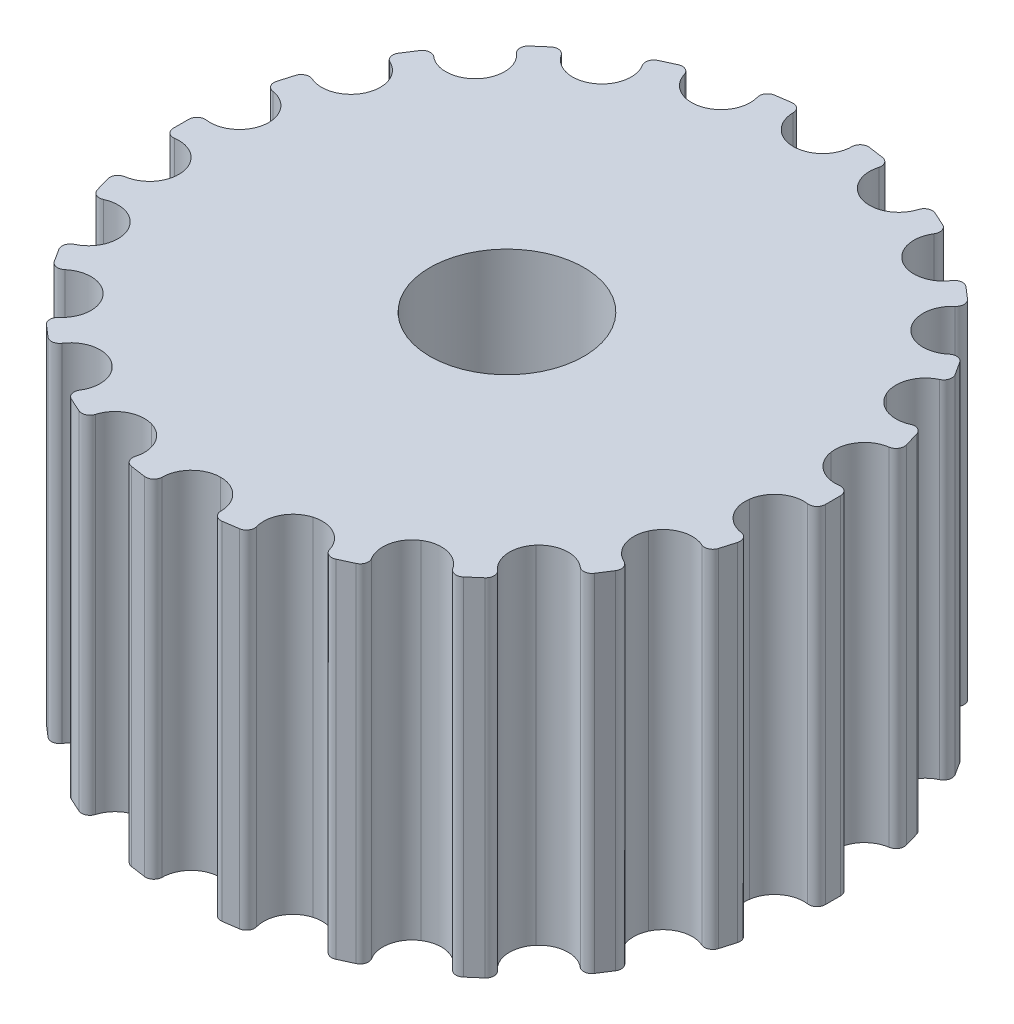
from build123d import *

# Parameters (mm, degrees)
AUFSATZ_LINEAR_AUSTRAGEN1_DEPTH = 18
F_8_0_8_DURCHMESSER_BOHRUNG1_D  = 8


with BuildPart() as part:
    # Skizze1 → Aufsatz-Linear austragen1 (new body)
    with BuildSketch(Plane(origin=(0, 0, 0), x_dir=(1, 0, 0), z_dir=(0, 1, 0))):
        with BuildLine():
            Line((2.016149839, 16.814436139), (2.801632478, 16.701526227))
            ThreePointArc((2.801632478, 16.701526227), (3.101511816, 16.50942794), (3.153726656, 16.157145411))
            ThreePointArc((3.153726656, 16.157145411), (3.283097912, 15.001210678), (4.189865695, 14.272723054))
            ThreePointArc((4.189865695, 14.272723054), (5.346528394, 14.395402891), (6.080251078, 15.297938189))
            ThreePointArc((6.080251078, 15.297938189), (6.314618428, 15.566081904), (6.67074882, 15.565580692))
            Line((6.67074882, 15.565580692), (7.392603495, 15.235948392))
            ThreePointArc((7.392603495, 15.235948392), (7.626215271, 14.967145662), (7.577065585, 14.614422431))
            ThreePointArc((7.577065585, 14.614422431), (7.375531949, 13.468863082), (8.040330584, 12.514418319))
            ThreePointArc((8.040330584, 12.514418319), (9.184703221, 12.306259221), (10.142978558, 12.965521931))
            ThreePointArc((10.142978558, 12.965521931), (10.443397198, 13.156775028), (10.784960599, 13.055960593))
            Line((10.784960599, 13.055960593), (11.384706937, 12.536310754))
            ThreePointArc((11.384706937, 12.536310754), (11.533125314, 12.212580381), (11.386592918, 11.887991985))
            ThreePointArc((11.386592918, 11.887991985), (10.870481446, 10.845614425), (11.239452902, 9.742535963))
            ThreePointArc((11.239452902, 9.742535963), (12.278825211, 9.220401742), (13.384019433, 9.582982318))
            ThreePointArc((13.384019433, 9.582982318), (13.726151231, 9.68185061), (14.025476205, 9.488890337))
            Line((14.025476205, 9.488890337), (14.454526325, 8.821321899))
            ThreePointArc((14.454526325, 8.821321899), (14.505727329, 8.468890591), (14.273683407, 8.198733253))
            ThreePointArc((14.273683407, 8.198733253), (13.48480638, 7.343984713), (13.528058784, 6.181637408))
            ThreePointArc((13.528058784, 6.181637408), (14.378227002, 5.387828273), (15.540803845, 5.424352595))
            ThreePointArc((15.540803845, 5.424352595), (15.896931319, 5.422826359), (16.129768337, 5.153352743))
            Line((16.129768337, 5.153352743), (16.353363149, 4.39194813))
            ThreePointArc((16.353363149, 4.39194813), (16.30319878, 4.039367777), (16.004442149, 3.845528037))
            ThreePointArc((16.004442149, 3.845528037), (15.006709693, 3.247655161), (14.720738993, 2.120205477))
            ThreePointArc((14.720738993, 2.120205477), (15.312827547, 1.119031124), (16.43860195, 0.826540208))
            ThreePointArc((16.43860195, 0.826540208), (16.779873768, 0.724743092), (16.92735976, 0.400587283))
            Line((16.92735976, 0.400587283), (16.927384943, -0.392969032))
            ThreePointArc((16.927384943, -0.392969032), (16.779919219, -0.717134467), (16.438653365, -0.818952866))
            ThreePointArc((16.438653365, -0.818952866), (15.31289583, -1.111513974), (14.72086967, -2.112726767))
            ThreePointArc((14.72086967, -2.112726767), (15.006911068, -3.240157147), (16.004679484, -3.837967426))
            ThreePointArc((16.004679484, -3.837967426), (16.303447834, -4.031788426), (16.353634362, -4.384365253))
            Line((16.353634362, -4.384365253), (16.130087875, -5.145784056))
            ThreePointArc((16.130087875, -5.145784056), (15.897267592, -5.415272618), (15.541139845, -5.416820955))
            ThreePointArc((15.541139845, -5.416820955), (14.378559411, -5.380368734), (13.528440231, -6.17423233))
            ThreePointArc((13.528440231, -6.17423233), (13.485261098, -7.336581031), (14.274190264, -8.191279641))
            ThreePointArc((14.274190264, -8.191279641), (14.50625071, -8.4614223), (14.455071961, -8.813856467))
            Line((14.455071961, -8.813856467), (14.026064211, -9.481452135))
            ThreePointArc((14.026064211, -9.481452135), (13.726751084, -9.674431463), (13.384612796, -9.5755843))
            ThreePointArc((13.384612796, -9.5755843), (12.279394816, -9.213071892), (11.240054215, -9.735272184))
            ThreePointArc((11.240054215, -9.735272184), (10.871152669, -10.838372629), (11.387328235, -11.880716971))
            ThreePointArc((11.387328235, -11.880716971), (11.533880622, -12.205295936), (11.385482792, -12.529035323))
            Line((11.385482792, -12.529035323), (10.785769436, -13.048723226))
            ThreePointArc((10.785769436, -13.048723226), (10.444212034, -13.149559283), (10.143781215, -12.95832463))
            ThreePointArc((10.143781215, -12.95832463), (9.185463876, -12.299120634), (8.041103048, -12.50735206))
            ThreePointArc((8.041103048, -12.50735206), (7.376365299, -13.461837611), (7.577969791, -14.607383145))
            ThreePointArc((7.577969791, -14.607383145), (7.627141314, -14.96010296), (7.393546714, -15.228920127))
            Line((7.393546714, -15.228920127), (6.671712961, -15.558598241))
            ThreePointArc((6.671712961, -15.558598241), (6.315582234, -15.559121889), (6.081198001, -15.29099244))
            ThreePointArc((6.081198001, -15.29099244), (5.347418475, -14.388501644), (4.19074673, -14.265894532))
            ThreePointArc((4.19074673, -14.265894532), (3.284025875, -14.994438446), (3.154726497, -16.150379885))
            ThreePointArc((3.154726497, -16.150379885), (3.102533573, -16.502665289), (2.802666647, -16.694782268))
            Line((2.802666647, -16.694782268), (2.017191175, -16.807742033))
            ThreePointArc((2.017191175, -16.807742033), (1.675338716, -16.707910849), (1.525989487, -16.384608858))
            ThreePointArc((1.525989487, -16.384608858), (1.076194227, -15.311945698), (0.00091823, -14.868432948))
            ThreePointArc((0.00091823, -14.868432948), (-1.074328599, -15.312012929), (-1.524056781, -16.384702774))
            ThreePointArc((-1.524056781, -16.384702774), (-1.673385793, -16.708013697), (-2.015231609, -16.807866313))
            Line((-2.015231609, -16.807866313), (-2.800714248, -16.6949564))
            ThreePointArc((-2.800714248, -16.6949564), (-3.100593586, -16.502858113), (-3.152808426, -16.150575585))
            ThreePointArc((-3.152808426, -16.150575585), (-3.282179682, -14.994640851), (-4.188947465, -14.266153228))
            ThreePointArc((-4.188947465, -14.266153228), (-5.345610164, -14.388833064), (-6.079332848, -15.291368363))
            ThreePointArc((-6.079332848, -15.291368363), (-6.313700199, -15.559512077), (-6.66983059, -15.559010865))
            Line((-6.66983059, -15.559010865), (-7.391685265, -15.229378565))
            ThreePointArc((-7.391685265, -15.229378565), (-7.625297041, -14.960575836), (-7.576147355, -14.607852605))
            ThreePointArc((-7.576147355, -14.607852605), (-7.374613719, -13.462293255), (-8.039412354, -12.507848493))
            ThreePointArc((-8.039412354, -12.507848493), (-9.183784991, -12.299689395), (-10.142060328, -12.958952104))
            ThreePointArc((-10.142060328, -12.958952104), (-10.442478968, -13.150205201), (-10.784042369, -13.049390766))
            Line((-10.784042369, -13.049390766), (-11.383788707, -12.529740927))
            ThreePointArc((-11.383788707, -12.529740927), (-11.532207084, -12.206010554), (-11.385674688, -11.881422159))
            ThreePointArc((-11.385674688, -11.881422159), (-10.869563216, -10.839044599), (-11.238534672, -9.735966136))
            ThreePointArc((-11.238534672, -9.735966136), (-12.277906981, -9.213831915), (-13.383101203, -9.576412492))
            ThreePointArc((-13.383101203, -9.576412492), (-13.725233001, -9.675280783), (-14.024557975, -9.482320511))
            Line((-14.024557975, -9.482320511), (-14.453608095, -8.814752072))
            ThreePointArc((-14.453608095, -8.814752072), (-14.5048091, -8.462320765), (-14.272765177, -8.192163427))
            ThreePointArc((-14.272765177, -8.192163427), (-13.48388815, -7.337414887), (-13.527140554, -6.175067581))
            ThreePointArc((-13.527140554, -6.175067581), (-14.377308772, -5.381258446), (-15.539885615, -5.417782768))
            ThreePointArc((-15.539885615, -5.417782768), (-15.896013089, -5.416256533), (-16.128850107, -5.146782917))
            Line((-16.128850107, -5.146782917), (-16.352444919, -4.385378304))
            ThreePointArc((-16.352444919, -4.385378304), (-16.30228055, -4.03279795), (-16.003523919, -3.838958211))
            ThreePointArc((-16.003523919, -3.838958211), (-15.005791463, -3.241085334), (-14.719820763, -2.113635651))
            ThreePointArc((-14.719820763, -2.113635651), (-15.311909317, -1.112461298), (-16.43768372, -0.819970382))
            ThreePointArc((-16.43768372, -0.819970382), (-16.778955538, -0.718173266), (-16.926441531, -0.394017456))
            Line((-16.926441531, -0.394017456), (-16.926466713, 0.399538858))
            ThreePointArc((-16.926466713, 0.399538858), (-16.779000989, 0.723704294), (-16.437735135, 0.825522693))
            ThreePointArc((-16.437735135, 0.825522693), (-15.3119776, 1.118083801), (-14.71995144, 2.119296594))
            ThreePointArc((-14.71995144, 2.119296594), (-15.005992838, 3.246726973), (-16.003761254, 3.844537253))
            ThreePointArc((-16.003761254, 3.844537253), (-16.302529604, 4.038358252), (-16.352716132, 4.39093508))
            Line((-16.352716132, 4.39093508), (-16.129169645, 5.152353882))
            ThreePointArc((-16.129169645, 5.152353882), (-15.896349362, 5.421842445), (-15.540221615, 5.423390781))
            ThreePointArc((-15.540221615, 5.423390781), (-14.377641181, 5.38693856), (-13.527522001, 6.180802156))
            ThreePointArc((-13.527522001, 6.180802156), (-13.484342868, 7.343150858), (-14.273272034, 8.197849468))
            ThreePointArc((-14.273272034, 8.197849468), (-14.505332481, 8.467992126), (-14.454153731, 8.820426293))
            Line((-14.454153731, 8.820426293), (-14.025145981, 9.488021961))
            ThreePointArc((-14.025145981, 9.488021961), (-13.725832854, 9.68100129), (-13.383694566, 9.582154127))
            ThreePointArc((-13.383694566, 9.582154127), (-12.278476586, 9.219641719), (-11.239135985, 9.741842011))
            ThreePointArc((-11.239135985, 9.741842011), (-10.870234439, 10.844942456), (-11.386410005, 11.887286797))
            ThreePointArc((-11.386410005, 11.887286797), (-11.532962392, 12.211865763), (-11.384564562, 12.53560515))
            Line((-11.384564562, 12.53560515), (-10.784851206, 13.055293052))
            ThreePointArc((-10.784851206, 13.055293052), (-10.443293804, 13.156129109), (-10.142862985, 12.964894457))
            ThreePointArc((-10.142862985, 12.964894457), (-9.184545646, 12.305690461), (-8.040184818, 12.513921887))
            ThreePointArc((-8.040184818, 12.513921887), (-7.375447069, 13.468407437), (-7.577051561, 14.613952971))
            ThreePointArc((-7.577051561, 14.613952971), (-7.626223084, 14.966672786), (-7.392628484, 15.235489954))
            Line((-7.392628484, 15.235489954), (-6.670794731, 15.565168067))
            ThreePointArc((-6.670794731, 15.565168067), (-6.314664004, 15.565691715), (-6.080279771, 15.297562267))
            ThreePointArc((-6.080279771, 15.297562267), (-5.346500245, 14.395071471), (-4.1898285, 14.272464359))
            ThreePointArc((-4.1898285, 14.272464359), (-3.283107646, 15.001008272), (-3.153808267, 16.156949712))
            ThreePointArc((-3.153808267, 16.156949712), (-3.101615343, 16.509235115), (-2.801748417, 16.701352094))
            Line((-2.801748417, 16.701352094), (-2.016272945, 16.814311859))
            ThreePointArc((-2.016272945, 16.814311859), (-1.674420486, 16.714480675), (-1.525071257, 16.391178685))
            ThreePointArc((-1.525071257, 16.391178685), (-1.075275997, 15.318515525), (0, 14.875002774))
            ThreePointArc((0, 14.875002774), (1.075246829, 15.318582755), (1.524975011, 16.3912726))
            ThreePointArc((1.524975011, 16.3912726), (1.674304023, 16.714583523), (2.016149839, 16.814436139))
        make_face()
    extrude(amount=AUFSATZ_LINEAR_AUSTRAGEN1_DEPTH)

    # Ø8.0 (8) Durchmesser Bohrung1 (through all)
    with Locations(Plane(origin=(0, 18, 0), x_dir=(1, 0, 0), z_dir=(0, 1, 0))):
        with Locations((0, 0)):
            Hole(F_8_0_8_DURCHMESSER_BOHRUNG1_D / 2)


solid = part.part
